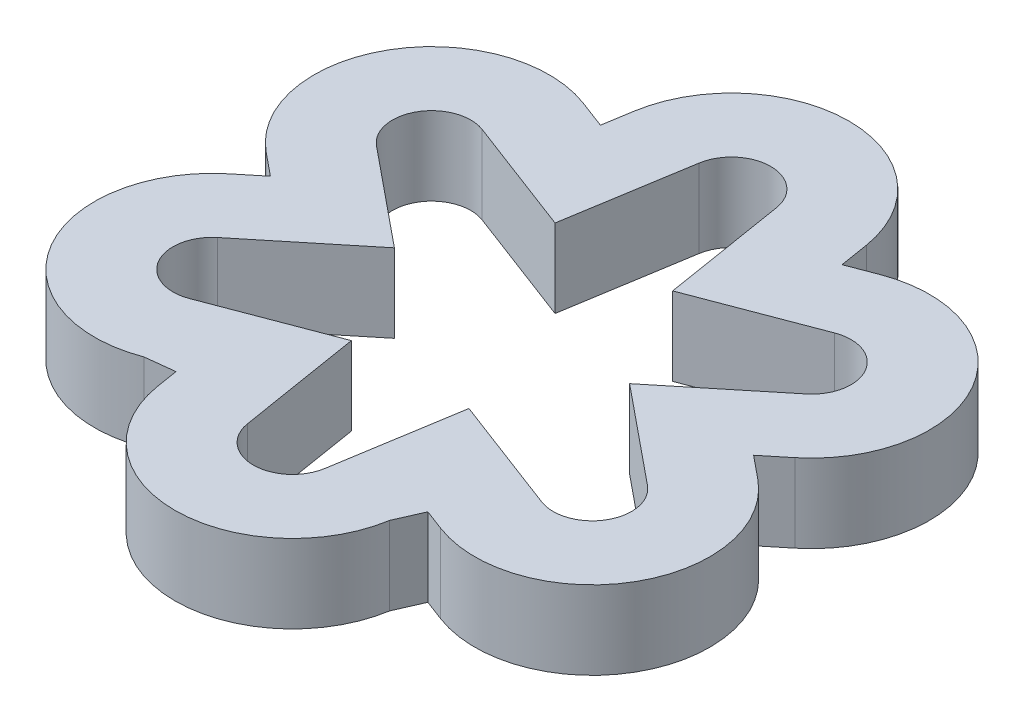
from build123d import *

# Parameters (mm, degrees)
BOSS_EXTRUDE1_DEPTH = 5


with BuildPart() as part:
    # Sketch1 → Boss-Extrude1 (new body)
    with BuildSketch(Plane(origin=(0, 0, 0), x_dir=(1, 0, 0), z_dir=(0, 1, 0))):
        with BuildLine():
            Line((-9.463376853, 14.012074716), (-7.70451588, 13.344612952))
            Line((-7.70451588, 13.344612952), (-7.403124237, 15.201562119))
            ThreePointArc((-7.403124237, 15.201562119), (0, 21.5), (7.403124237, 15.201562119))
            Line((7.403124237, 15.201562119), (7.70451588, 13.344612952))
            Line((7.70451588, 13.344612952), (9.463376853, 14.012074716))
            ThreePointArc((9.463376853, 14.012074716), (18.619546181, 10.75), (16.866501091, 1.189487402))
            Line((16.866501091, 1.189487402), (15.40903176, 0))
            Line((15.40903176, 0), (16.866501091, -1.189487402))
            ThreePointArc((16.866501091, -1.189487402), (18.619546181, -10.75), (9.463376853, -14.012074716))
            Line((9.463376853, -14.012074716), (8.145790319, -13.512070085))
            Line((8.145790319, -13.512070085), (7.403124237, -15.201562119))
            ThreePointArc((7.403124237, -15.201562119), (0, -21.5), (-7.403124237, -15.201562119))
            Line((-7.403124237, -15.201562119), (-7.630525703, -13.800484906))
            Line((-7.630525703, -13.800484906), (-9.463376853, -14.012074716))
            ThreePointArc((-9.463376853, -14.012074716), (-18.619546181, -10.75), (-16.866501091, -1.189487402))
            Line((-16.866501091, -1.189487402), (-15.40903176, 0))
            Line((-15.40903176, 0), (-16.866501091, 1.189487402))
            ThreePointArc((-16.866501091, 1.189487402), (-18.619546181, 10.75), (-9.463376853, 14.012074716))
        make_face()
        with BuildLine():
            ThreePointArc((-11.23736272, 9.337358239), (-14.289419162, 8.25), (-13.705070799, 5.063162467))
            Line((-13.705070799, 5.063162467), (-7.504165125, 0.002404736))
            Line((-7.504165125, 0.002404736), (-7.504165125, -0.002404736))
            Line((-7.504165125, -0.002404736), (-13.705070799, -5.063162467))
            ThreePointArc((-13.705070799, -5.063162467), (-14.289419162, -8.25), (-11.23736272, -9.337358239))
            Line((-11.23736272, -9.337358239), (-3.754165125, -6.497595264))
            Line((-3.754165125, -6.497595264), (-3.75, -6.5))
            Line((-3.75, -6.5), (-2.467708079, -14.400520706))
            ThreePointArc((-2.467708079, -14.400520706), (0, -16.5), (2.467708079, -14.400520706))
            Line((2.467708079, -14.400520706), (3.75, -6.5))
            Line((3.75, -6.5), (3.754165125, -6.497595264))
            Line((3.754165125, -6.497595264), (11.23736272, -9.337358239))
            ThreePointArc((11.23736272, -9.337358239), (14.289419162, -8.25), (13.705070799, -5.063162467))
            Line((13.705070799, -5.063162467), (7.504165125, -0.002404736))
            Line((7.504165125, -0.002404736), (7.504165125, 0.002404736))
            Line((7.504165125, 0.002404736), (13.705070799, 5.063162467))
            ThreePointArc((13.705070799, 5.063162467), (14.289419162, 8.25), (11.23736272, 9.337358239))
            Line((11.23736272, 9.337358239), (3.754165125, 6.497595264))
            Line((3.754165125, 6.497595264), (3.75, 6.5))
            Line((3.75, 6.5), (2.467708079, 14.400520706))
            ThreePointArc((2.467708079, 14.400520706), (0, 16.5), (-2.467708079, 14.400520706))
            Line((-2.467708079, 14.400520706), (-3.75, 6.5))
            Line((-3.75, 6.5), (-3.754165125, 6.497595264))
            Line((-3.754165125, 6.497595264), (-11.23736272, 9.337358239))
        make_face(mode=Mode.SUBTRACT)
    extrude(amount=BOSS_EXTRUDE1_DEPTH)


solid = part.part
